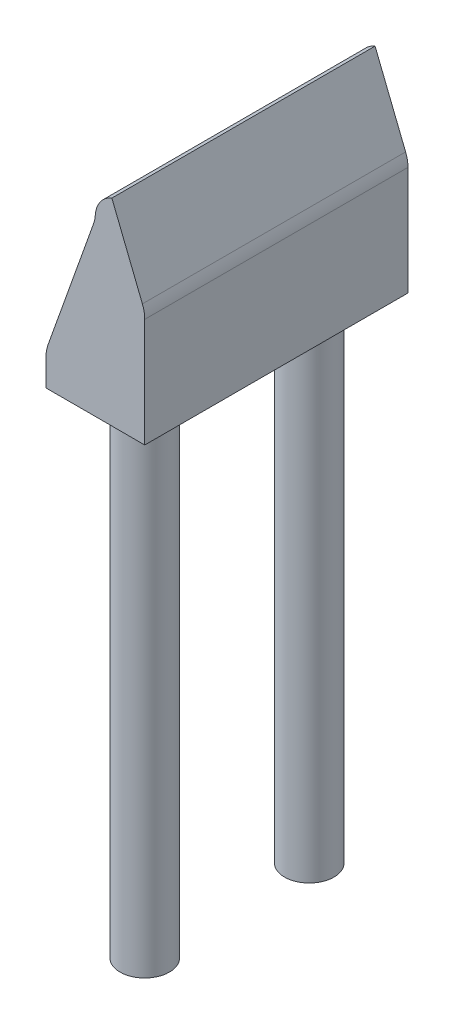
from build123d import *

# Parameters (mm, degrees)
SKETCH1_W           = 30
SKETCH1_H           = 80
BOSS_EXTRUDE1_DEPTH = 10
BOSS_EXTRUDE2_DEPTH = 80
FILLET1_R           = 10
FILLET2_R           = 10
FILLET4_R           = 10
SKETCH3_R           = 7.5
BOSS_EXTRUDE3_DEPTH = 150


with BuildPart() as part:
    # Sketch1 → Boss-Extrude1 (new body)
    with BuildSketch(Plane(origin=(0, 0, 0), x_dir=(1, 0, 0), z_dir=(0, 1, 0))):
        with Locations((-15, 40)):
            Rectangle(SKETCH1_W, SKETCH1_H)
    extrude(amount=BOSS_EXTRUDE1_DEPTH)

    # Sketch2 → Boss-Extrude2 (add)
    with BuildSketch(Plane(origin=(0, 0, -80), x_dir=(-1, 0, 0), z_dir=(0, 0, -1))):
        with BuildLine():
            Line((0, 10), (0, 35))
            Line((0, 35), (10, 60))
            ThreePointArc((10, 60), (13.809664499, 56.817288145), (15.008386018, 52))
            Line((15.008386018, 52), (30, 10))
            Line((30, 10), (30, 0))
            Line((30, 0), (0, 0))
            Line((0, 0), (0, 10))
        make_face()
    extrude(amount=-BOSS_EXTRUDE2_DEPTH)

    # Fillet1
    fillet1_edges = [part.edges().sort_by_distance(p)[0] for p in [
        (0, 35, -40),
    ]]
    fillet(fillet1_edges, radius=FILLET1_R)

    # Fillet2
    fillet2_edges = [part.edges().sort_by_distance(p)[0] for p in [
        (-15.008386018, 52, -40),
    ]]
    fillet(fillet2_edges, radius=FILLET2_R)

    # Fillet4
    fillet4_edges = [part.edges().sort_by_distance(p)[0] for p in [
        (-30, 10, -40),
    ]]
    fillet(fillet4_edges, radius=FILLET4_R)

    # Sketch3 → Boss-Extrude3 (add)
    with BuildSketch(Plane.XZ):
        with Locations(Location((-15, -15, 0), (0, 0, 90))):
            Circle(SKETCH3_R)
        with Locations(Location((-15, -65, 0), (0, 0, 90))):
            Circle(SKETCH3_R)
    extrude(amount=BOSS_EXTRUDE3_DEPTH)


solid = part.part
